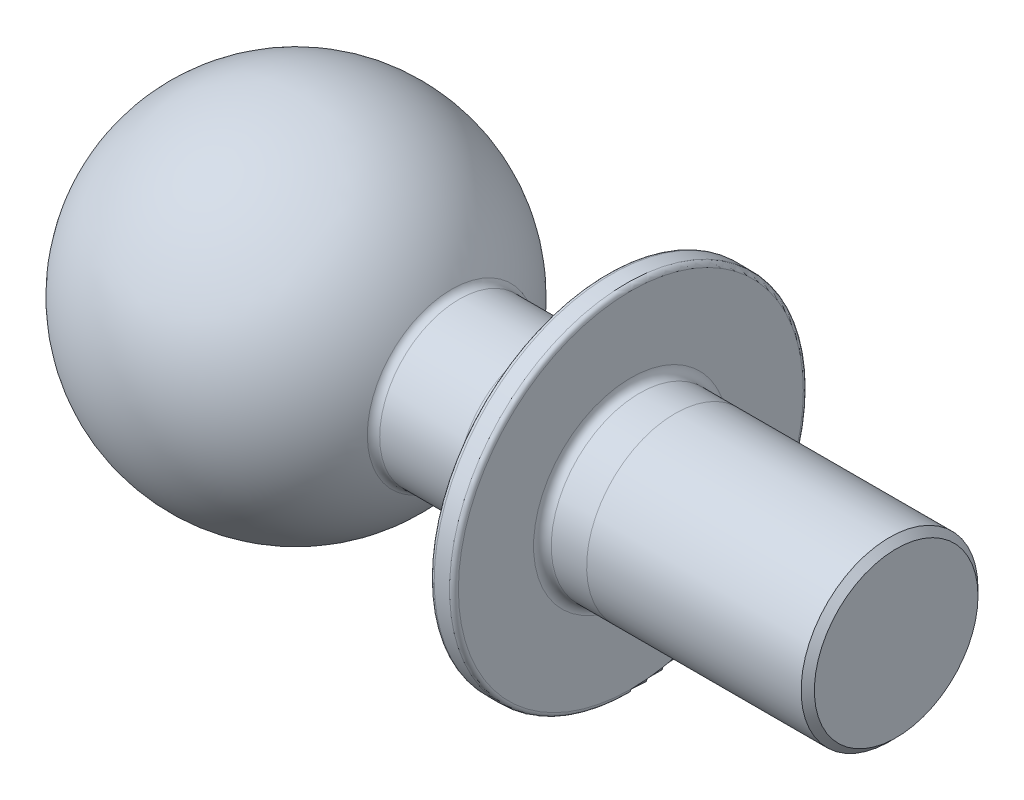
from build123d import *

# Parameters (mm, degrees)
CHAMFER1_SIZE      = 0.075
FILLET1_R          = 0.1
FILLET2_R          = 0.05
CUT_EXTRUDE1_DEPTH = 1
FILLET3_R          = 0.05


with BuildPart() as part:
    # Sketch1 → Revolve1 (revolve)
    with BuildSketch(Plane.XY, mode=Mode.PRIVATE) as revolve1_sk:
        with BuildLine():
            Line((0, 0), (0, 1))
            Line((0, 1), (-3, 1))
            Line((-3, 1), (-3, 2))
            Line((-3, 2), (-3.25, 2))
            Line((-3.25, 2), (-4, 0.9))
            Line((-4, 0.9), (-5, 0.9))
            ThreePointArc((-5, 0.9), (-6.800005741, 1.999951358), (-8.584493931, 0.875))
            Line((-8.584493931, 0.875), (-8.584493931, 0))
            Line((-8.584493931, 0), (-5, 0))
            Line((-5, 0), (0, 0))
        make_face()
    revolve(revolve1_sk.sketch.rotate(Axis((0, 0, 0), (-1, 0, 0)), 90), axis=Axis((0, 0, 0), (-1, 0, 0)))

    # Chamfer1
    chamfer1_edges = [part.edges().sort_by_distance(p)[0] for p in [
        (0, 0, 1),
    ]]
    chamfer(chamfer1_edges, length=CHAMFER1_SIZE)

    # Fillet1
    fillet1_edges = [part.edges().sort_by_distance(p)[0] for p in [
        (-4, 0, 0.9),
        (-5, 0, 0.9),
        (-3, 0, 1),
    ]]
    fillet(fillet1_edges, radius=FILLET1_R)

    # Fillet2
    fillet2_edges = [part.edges().sort_by_distance(p)[0] for p in [
        (-3, 0, 2),
        (-3.25, 0, 2),
    ]]
    fillet(fillet2_edges, radius=FILLET2_R)

    # Sketch3 → Cut-Extrude1 (cut)
    with BuildSketch(Plane.ZY.offset(8.584493931)):
        Polygon((0, 0.66395281), (-0.575, 0.331976405), (-0.575, -0.331976405), (0, -0.66395281), (0.575, -0.331976405), (0.575, 0.331976405), align=None)
    extrude(amount=-CUT_EXTRUDE1_DEPTH, mode=Mode.SUBTRACT)

    # Fillet3
    fillet3_edges = [part.edges().sort_by_distance(p)[0] for p in [
        (-7.584493931, 0, 0.575),
        (-8.084493931, 0.331976405, 0.575),
        (-7.584493931, -0.497964607, 0.2875),
        (-8.084493931, -0.331976405, 0.575),
        (-7.584493931, -0.497964607, -0.2875),
        (-8.084493931, -0.66395281, 0),
        (-7.584493931, 0, -0.575),
        (-8.084493931, -0.331976405, -0.575),
        (-7.584493931, 0.497964607, -0.2875),
        (-8.084493931, 0.331976405, -0.575),
        (-7.584493931, 0.497964607, 0.2875),
        (-8.084493931, 0.66395281, 0),
        (-8.584493931, 0, 0.575),
        (-8.584493931, 0.497964607, 0.2875),
        (-8.584493931, 0.497964607, -0.2875),
        (-8.584493931, 0, -0.575),
        (-8.584493931, -0.497964607, -0.2875),
        (-8.584493931, -0.497964607, 0.2875),
    ]]
    fillet(fillet3_edges, radius=FILLET3_R)


solid = part.part
